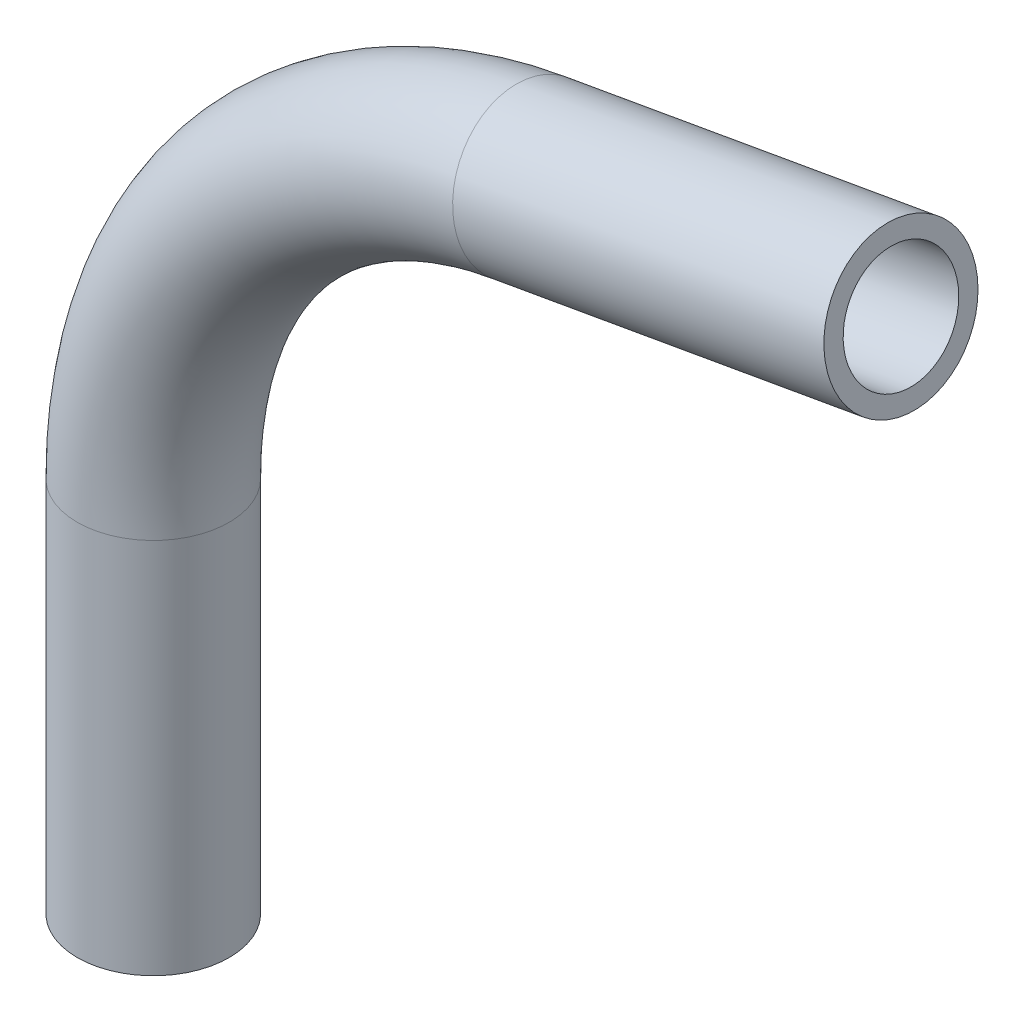
from build123d import *

# Parameters (mm, degrees)
SKETCH2_R   = 4
SKETCH2_R_2 = 3


with BuildPart() as part:
    # Sweep1: sweep along a path in Sketch1
    with BuildLine(Plane.XY) as sweep1_path:
        Line((0, 0), (0, 19.861608852))
        ThreePointArc((0, 19.861608852), (5.614933365, 35.288511484), (19.832443736, 43.496994924))
        Line((19.832443736, 43.496994924), (39.39231012, 46.945927107))
    # Sketch2 → Sweep1 (sweep)
    with BuildSketch(Plane(origin=(0, 0, 0), x_dir=(1, 0, 0), z_dir=(0, 1, 0))):
        Circle(SKETCH2_R)
        Circle(SKETCH2_R_2, mode=Mode.SUBTRACT)
    sweep(path=sweep1_path.line)


solid = part.part
